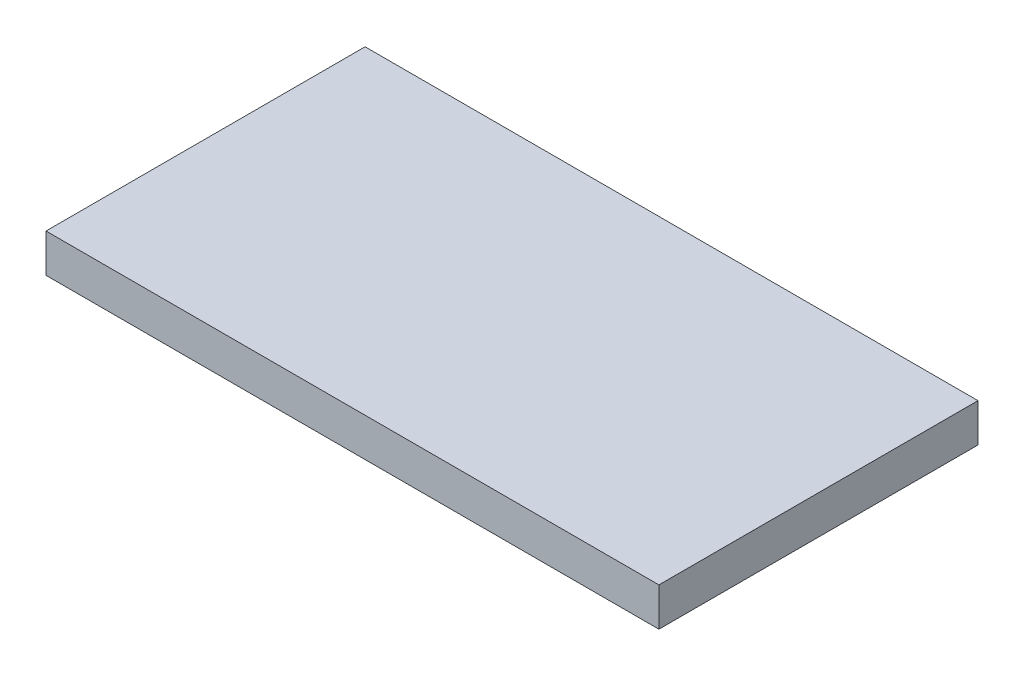
from build123d import *

# Parameters (mm, degrees)
SKETCH1_W           = 304.0049
SKETCH1_H           = 158.2674
BOSS_EXTRUDE1_DEPTH = 19.05


with BuildPart() as part:
    # Sketch1 → Boss-Extrude1 (new body)
    with BuildSketch(Plane(origin=(0, 0, 0), x_dir=(1, 0, 0), z_dir=(0, 1, 0))):
        with Locations((91.799137241, 58.123660649)):
            Rectangle(SKETCH1_W, SKETCH1_H)
    extrude(amount=BOSS_EXTRUDE1_DEPTH)


solid = part.part
